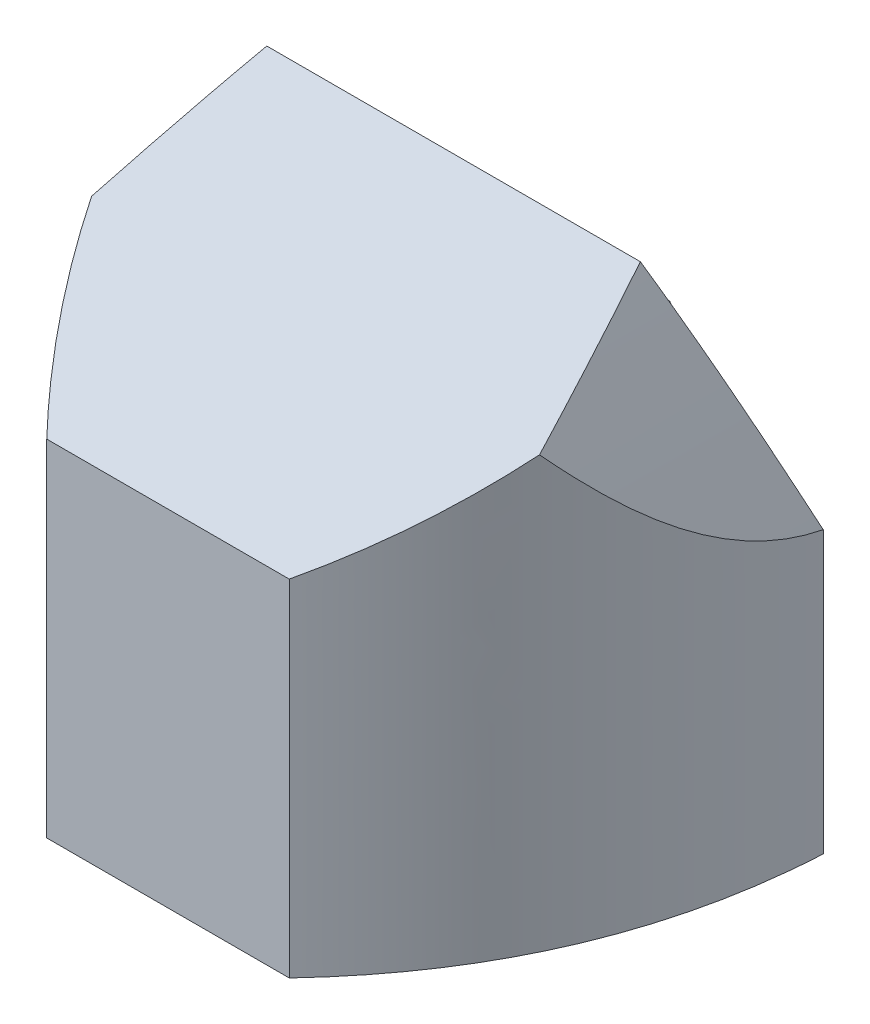
from build123d import *

# Parameters (mm, degrees)
BOSS_EXTRUDE1_DEPTH = 500
CUT_EXTRUDE1_DEPTH  = 1000
CUT_EXTRUDE2_DEPTH  = 1000
SKETCH5_W           = 533.4
SKETCH5_H           = 228.6
SKETCH5_W_2         = 508
SKETCH5_H_2         = 203.2
BOSS_EXTRUDE2_DEPTH = 3.175
SKETCH6_W           = 152.4
SKETCH6_H           = 375
CUT_EXTRUDE4_DEPTH  = 381
BOSS_EXTRUDE4_DEPTH = 76.2


with BuildPart() as part:
    # Sketch2 → Boss-Extrude1 (new, symmetric)
    with BuildSketch(Plane(origin=(0, 0, 0), x_dir=(0, 0, -1), z_dir=(1, 0, 0))):
        Polygon((0, -750), (-500, -750), (-500, -288.675134595), (-118.676951522, -68.518169908), (0, -375), align=None)
    extrude(amount=BOSS_EXTRUDE1_DEPTH, both=True)

    # Sketch3 → Cut-Extrude1 (cut)
    with BuildSketch(Plane.XZ.offset(750)):
        with BuildLine():
            Line((-161.921680379, 500), (-500, 500))
            Line((-500, 500), (-500, 0))
            Line((-500, 0), (-375, 0))
            add(Edge.make_bspline(
                [(-375, 0), (-359.934223317, 289.431587022), (-161.921680379, 500)],
                knots=[0, 0, 0, 1, 1, 1], degree=2))
        make_face()
        with BuildLine():
            Line((500, 0), (500, 500))
            Line((500, 500), (161.921680379, 500))
            add(Edge.make_bspline(
                [(375, 0), (359.934223317, 289.431587022), (161.921680379, 500)],
                knots=[0, 0, 0, 1, 1, 1], degree=2))
            Line((375, 0), (500, 0))
        make_face()
    extrude(amount=-CUT_EXTRUDE1_DEPTH, mode=Mode.SUBTRACT)

    # Sketch4 → Cut-Extrude2 (cut)
    with BuildSketch(Plane(origin=(0, 0, 0), x_dir=(-1, 0, 0), z_dir=(0, 0, -1))):
        with BuildLine():
            Line((-375, -375), (-996.294304176, -375))
            Line((-996.294304176, -375), (-996.294304176, 371.909901341))
            Line((-996.294304176, 371.909901341), (846.489564783, 371.909901341))
            Line((846.489564783, 371.909901341), (846.489564783, -375))
            Line((846.489564783, -375), (375, -375))
            add(Edge.make_bspline(
                [(-375, -375), (0, 724.407090278), (375, -375)],
                knots=[0, 0, 0, 1, 1, 1], degree=2))
        make_face()
    extrude(amount=-CUT_EXTRUDE2_DEPTH, mode=Mode.SUBTRACT)

    # Sketch5 → Boss-Extrude2 (add)
    with BuildSketch(Plane(origin=(0, -48.896596526, 126.274884856), x_dir=(-1, 0, 0), z_dir=(0, 0.36109683475385423, -0.9325283244656689))):
        with Locations((0, -187.918797542)):
            Rectangle(SKETCH5_W, SKETCH5_H)
        with Locations((0, -187.918797542)):
            Rectangle(SKETCH5_W_2, SKETCH5_H_2, mode=Mode.SUBTRACT)
    extrude(amount=BOSS_EXTRUDE2_DEPTH)

    # Sketch6 → Cut-Extrude4 (cut)
    with BuildSketch(Plane(origin=(0, 0, 0), x_dir=(-1, 0, 0), z_dir=(0, 0, -1))):
        with Locations((-177.8, -562.5)):
            Rectangle(SKETCH6_W, SKETCH6_H)
        with Locations((177.8, -562.5)):
            Rectangle(SKETCH6_W, SKETCH6_H)
    extrude(amount=-CUT_EXTRUDE4_DEPTH, mode=Mode.SUBTRACT)

    # Sketch7 → Boss-Extrude4 (add, symmetric)
    with BuildSketch(Plane(origin=(0, 0, 0), x_dir=(0, 0, -1), z_dir=(1, 0, 0))):
        Polygon((0, -375), (152.4, -566.804213416), (152.4, -750), (0, -750), align=None)
    extrude(amount=BOSS_EXTRUDE4_DEPTH, both=True)


solid = part.part
